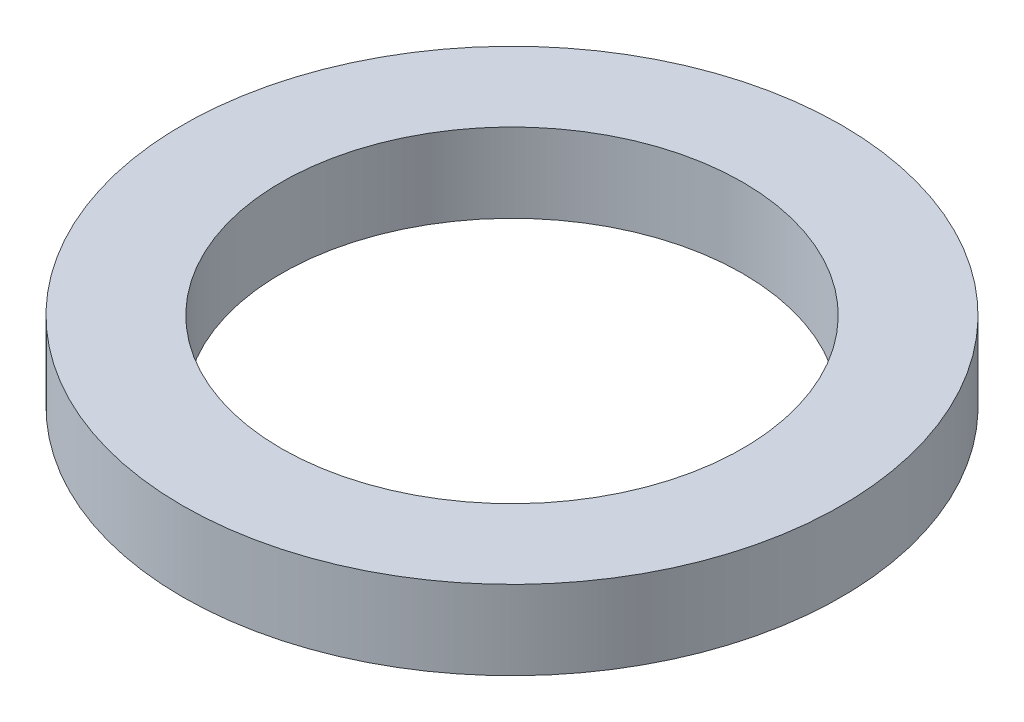
from build123d import *

# Parameters (mm, degrees)
CROQUIS1_R              = 2.5
CROQUIS1_R_2            = 1.75
SALIENTE_EXTRUIR1_DEPTH = 0.6


with BuildPart() as part:
    # Croquis1 → Saliente-Extruir1 (new body)
    with BuildSketch(Plane(origin=(0, 0, 0), x_dir=(1, 0, 0), z_dir=(0, 1, 0))):
        with Locations(Location((0, 0, 0), (0, 0, 270))):
            Circle(CROQUIS1_R)
        with Locations(Location((0, 0, 0), (0, 0, 270))):
            Circle(CROQUIS1_R_2, mode=Mode.SUBTRACT)
    extrude(amount=SALIENTE_EXTRUIR1_DEPTH)


solid = part.part
